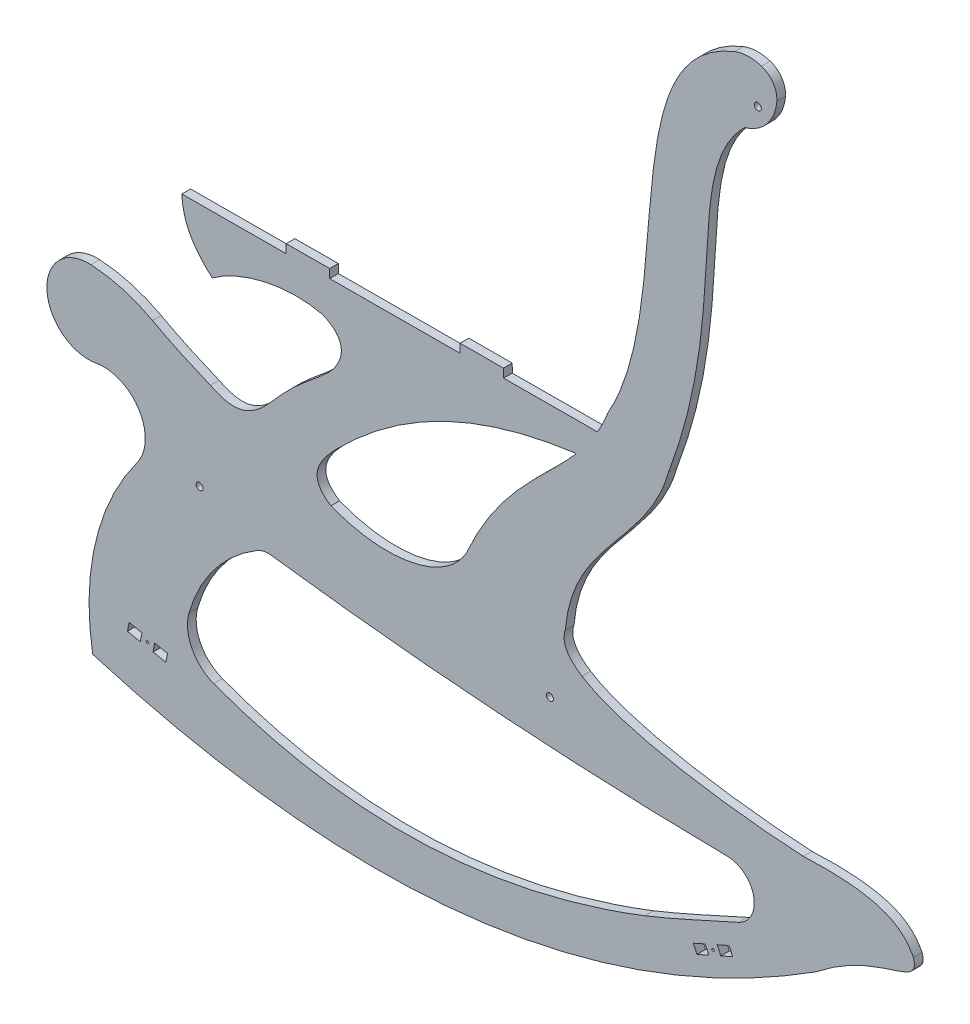
from build123d import *

# Parameters (mm, degrees)
EXTRUDE_3344_DEPTH     = 10
EXTRUDE_7001_DEPTH     = 10
CUT_EXTRUDE_7885_REACH = 1081.252
SKETCH6_R              = 1.5
SKETCH10_R             = 4
CUT_EXTRUDE2_DEPTH     = 10


with BuildPart() as part:
    # Sketch 366 → Extrude 3344 (new body)
    with BuildSketch(Plane.XY):
        with BuildLine():
            Line((398.785011417, -200.651493516), (-79.294784876, -202.700029576))
            add(Edge.make_bspline(
                [(-79.294784876, -202.700029576), (-78.517207033, -227.700030074), (-66.77413567, -249.709423293), (-44.177194857, -268.758733778)],
                knots=[0.130434783, 0.130434783, 0.130434783, 0.130434783, 0.173913043, 0.173913043, 0.173913043, 0.173913043], degree=3))
            add(Edge.make_bspline(
                [(-44.177194857, -268.758733778), (-12.705791537, -245.829015584), (38.959692419, -231.734357298), (82.666649693, -241.803965427)],
                knots=[0.173913043, 0.173913043, 0.173913043, 0.173913043, 0.217391304, 0.217391304, 0.217391304, 0.217391304], degree=3))
            add(Edge.make_bspline(
                [(82.666649693, -241.803965427), (105.678664452, -251.652519997), (111.246401119, -268.691898993), (94.211511027, -290.72343747)],
                knots=[0.217391304, 0.217391304, 0.217391304, 0.217391304, 0.260869565, 0.260869565, 0.260869565, 0.260869565], degree=3))
            add(Edge.make_bspline(
                [(94.211511027, -290.72343747), (87.158146802, -299.84568745), (74.983143168, -308.421687748), (61.059861243, -320.502125148)],
                knots=[0.260869565, 0.260869565, 0.260869565, 0.260869565, 0.304347826, 0.304347826, 0.304347826, 0.304347826], degree=3))
            add(Edge.make_bspline(
                [(61.059861243, -320.502125148), (47.380576162, -331.841195194), (34.883169502, -345.267804883), (22.870464668, -359.106695422)],
                knots=[0.304347826, 0.304347826, 0.304347826, 0.304347826, 0.347826087, 0.347826087, 0.347826087, 0.347826087], degree=3))
            add(Edge.make_bspline(
                [(22.870464668, -359.106695422), (-5.584395486, -391.889656597), (-25.592236503, -386.636342684), (-46.417157713, -376.787588607)],
                knots=[0.347826087, 0.347826087, 0.347826087, 0.347826087, 0.391304348, 0.391304348, 0.391304348, 0.391304348], degree=3))
            add(Edge.make_bspline(
                [(-46.417157713, -376.787588607), (-71.990241561, -366.221906762), (-92.784039707, -356.68149048), (-112.974728727, -345.609360564)],
                knots=[0.391304348, 0.391304348, 0.391304348, 0.391304348, 0.434782609, 0.434782609, 0.434782609, 0.434782609], degree=3))
            ThreePointArc((-112.974728727, -345.609360564), (-147.291018167, -331.50605668), (-183.878601839, -325.353039337))
            ThreePointArc((-183.878601839, -325.353039337), (-234.41691777, -376.347060605), (-177.788935429, -420.480757462))
            ThreePointArc((-177.788935429, -420.480757462), (-128.557787466, -442.172804122), (-130.703269603, -495.928247794))
            ThreePointArc((-130.703269603, -495.928247794), (-178.505297895, -598.929354982), (-181.694355183, -712.437468808))
            add(Edge.make_bspline(
                [(-181.694355183, -712.437468808), (138.462224148, -807.731703363), (410.691079854, -765.39904884), (650.190442214, -612.598169561)],
                knots=[0.652173913, 0.652173913, 0.652173913, 0.652173913, 0.695652174, 0.695652174, 0.695652174, 0.695652174], degree=3))
            add(Edge.make_bspline(
                [(650.190442214, -612.598169561), (721.726306985, -555.13661338), (771.374178439, -572.802842814), (761.971022851, -542.438303349)],
                knots=[0.695652174, 0.695652174, 0.695652174, 0.695652174, 0.739130435, 0.739130435, 0.739130435, 0.739130435], degree=3))
            add(Edge.make_bspline(
                [(761.971022851, -542.438303349), (749.988144288, -518.251093648), (723.103402832, -500.836242812), (635.239899657, -505.006434182)],
                knots=[0.739130435, 0.739130435, 0.739130435, 0.739130435, 0.782608696, 0.782608696, 0.782608696, 0.782608696], degree=3))
            add(Edge.make_bspline(
                [(635.239899657, -505.006434182), (572.991975282, -501.932832065), (433.550272387, -486.778792548), (380.910397107, -452.903731023)],
                knots=[0.782608696, 0.782608696, 0.782608696, 0.782608696, 0.826086957, 0.826086957, 0.826086957, 0.826086957], degree=3))
            add(Edge.make_bspline(
                [(380.910397107, -452.903731023), (364.765905966, -442.514313456), (356.786231562, -430.363849161), (361.702578451, -416.260911342)],
                knots=[0.826086957, 0.826086957, 0.826086957, 0.826086957, 0.869565217, 0.869565217, 0.869565217, 0.869565217], degree=3))
            add(Edge.make_bspline(
                [(361.702578451, -416.260911342), (369.757666434, -319.561849491), (455.747401527, -287.137003064), (480.242749516, -200.302456329)],
                knots=[0.869565217, 0.869565217, 0.869565217, 0.869565217, 0.913043478, 0.913043478, 0.913043478, 0.913043478], degree=3))
            add(Edge.make_bspline(
                [(480.242749516, -200.302456329), (553.544349425, -5.601453319), (495.010045056, 115.276837959), (568.085803242, 187.174308847)],
                knots=[0.913043478, 0.913043478, 0.913043478, 0.913043478, 0.956521739, 0.956521739, 0.956521739, 0.956521739], degree=3))
            ThreePointArc((568.085803242, 187.174308847), (593.606841589, 203.592061702), (604.925253944, 231.748047725))
            ThreePointArc((604.925253944, 231.748047725), (600.64196866, 247.878688747), (587.30163028, 257.907621119))
            ThreePointArc((587.30163028, 257.907621119), (571.737485415, 260.097118561), (556.344046154, 256.922448156))
            add(Edge.make_bspline(
                [(556.344046154, 256.922448156), (413.493143177, 200.699964154), (492.80385804, -30.446360595), (410.726691822, -175.599321984)],
                knots=[0.000400641, 0.000400641, 0.000400641, 0.000400641, 0.043478261, 0.043478261, 0.043478261, 0.043478261], degree=3))
            add(Edge.make_bspline(
                [(410.726691822, -175.599321984), (407.231033021, -184.649150987), (403.219250068, -192.928185379), (398.785011417, -200.651493516)],
                knots=[0.043478261, 0.043478261, 0.043478261, 0.043478261, 0.086956522, 0.086956522, 0.086956522, 0.086956522], degree=3))
        make_face()
        with BuildLine():
            ThreePointArc((560.346734066, -608.221488629), (578.34219742, -573.494082411), (548.198906447, -548.569968521))
            ThreePointArc((548.198906447, -548.569968521), (285.319700334, -537.637629059), (23.550736383, -511.142298049))
            ThreePointArc((23.550736383, -511.142298049), (15.100477301, -511.443853236), (7.211162456, -514.486307076))
            ThreePointArc((7.211162456, -514.486307076), (-41.568101768, -557.565567627), (-70.986403303, -615.615570579))
            ThreePointArc((-70.986403303, -615.615570579), (-67.830334276, -649.354197638), (-42.606278131, -671.981674723))
            add(Edge.make_bspline(
                [(452.957398359, -655.370237863), (274.711219353, -724.494962923), (109.739326577, -728.980973594), (-42.606278131, -671.981674723)],
                knots=[0.555555556, 0.555555556, 0.555555556, 0.555555556, 0.666666667, 0.666666667, 0.666666667, 0.666666667], degree=3))
            add(Edge.make_bspline(
                [(560.346734066, -608.221488629), (524.550322081, -623.937738374), (490.70019891, -640.488126146), (452.957398359, -655.370237863)],
                knots=[0.444444444, 0.444444444, 0.444444444, 0.444444444, 0.555555556, 0.555555556, 0.555555556, 0.555555556], degree=3))
        make_face(mode=Mode.SUBTRACT)
        with BuildLine():
            add(Edge.make_bspline(
                [(97.461776435, -368.948566513), (168.620673064, -296.351125936), (255.441952596, -250.089184531), (374.508522413, -234.330838847)],
                knots=[0.75, 0.75, 0.75, 0.75, 1, 1, 1, 1], degree=3))
            add(Edge.make_bspline(
                [(374.508522413, -234.330838847), (336.704373514, -278.003480948), (285.636212987, -310.964302456), (247.882738821, -396.645799506)],
                knots=[0, 0, 0, 0, 0.25, 0.25, 0.25, 0.25], degree=3))
            add(Edge.make_bspline(
                [(247.882738821, -396.645799506), (222.475445143, -441.097914765), (152.691350033, -451.719558275), (92.090753497, -427.546413805)],
                knots=[0.25, 0.25, 0.25, 0.25, 0.5, 0.5, 0.5, 0.5], degree=3))
            add(Edge.make_bspline(
                [(92.090753497, -427.546413805), (69.794668972, -412.531131284), (70.490548771, -396.456667038), (97.461776435, -368.948566513)],
                knots=[0.5, 0.5, 0.5, 0.5, 0.75, 0.75, 0.75, 0.75], degree=3))
        make_face(mode=Mode.SUBTRACT)
    extrude(amount=EXTRUDE_3344_DEPTH)

    # Sketch5 → Extrude 7001 (add)
    with BuildSketch(Plane.XY.offset(10)):
        Polygon((40.661264648, -192.185935101), (90.66080564, -191.971690819), (90.703654496, -201.971599017), (40.704113505, -202.185843299), align=None)
        Polygon((240.659428615, -191.328957973), (290.658969607, -191.114713691), (290.701818463, -201.114621889), (240.702277472, -201.328866171), align=None)
    extrude(amount=-EXTRUDE_7001_DEPTH)

    # Sketch6 → Cut-Extrude 7885 (cut, up to next)
    with BuildSketch(Plane.XY.offset(10), mode=Mode.PRIVATE) as cut_extrude_7885_sk1:
        with Locations((531.551481114, -650.112952006)):
            Circle(SKETCH6_R)
    cut_extrude_7885_tool1 = extrude(cut_extrude_7885_sk1.sketch, amount=-CUT_EXTRUDE_7885_REACH, mode=Mode.PRIVATE) & part.part
    # Sketch6 → Cut-Extrude 7885 (cut, up to next)
    with BuildSketch(Plane.XY.offset(10), mode=Mode.PRIVATE) as cut_extrude_7885_sk2:
        with Locations((-118.7617531, -668.979567573)):
            Circle(SKETCH6_R)
    cut_extrude_7885_tool2 = extrude(cut_extrude_7885_sk2.sketch, amount=-CUT_EXTRUDE_7885_REACH, mode=Mode.PRIVATE) & part.part
    # Sketch6 → Cut-Extrude 7885 (cut, up to next)
    with BuildSketch(Plane.XY.offset(10), mode=Mode.PRIVATE) as cut_extrude_7885_sk3:
        Polygon((-139.846242547, -659.668589925), (-141.805292897, -669.474818645), (-127.095949816, -672.413394171), (-125.136899465, -662.60716545), align=None)
    cut_extrude_7885_tool3 = extrude(cut_extrude_7885_sk3.sketch, amount=-CUT_EXTRUDE_7885_REACH, mode=Mode.PRIVATE) & part.part
    # Sketch6 → Cut-Extrude 7885 (cut, up to next)
    with BuildSketch(Plane.XY.offset(10), mode=Mode.PRIVATE) as cut_extrude_7885_sk4:
        Polygon((-112.386606734, -675.351969696), (-110.427556384, -665.545740975), (-95.718213303, -668.4843165), (-97.677263653, -678.290545221), align=None)
    cut_extrude_7885_tool4 = extrude(cut_extrude_7885_sk4.sketch, amount=-CUT_EXTRUDE_7885_REACH, mode=Mode.PRIVATE) & part.part
    # Sketch6 → Cut-Extrude 7885 (cut, up to next)
    with BuildSketch(Plane.XY.offset(10), mode=Mode.PRIVATE) as cut_extrude_7885_sk5:
        Polygon((554.142933289, -645.543894263), (540.435760059, -651.635971254), (536.374375399, -642.497855768), (550.081548628, -636.405778777), align=None)
    cut_extrude_7885_tool5 = extrude(cut_extrude_7885_sk5.sketch, amount=-CUT_EXTRUDE_7885_REACH, mode=Mode.PRIVATE) & part.part
    # Sketch6 → Cut-Extrude 7885 (cut, up to next)
    with BuildSketch(Plane.XY.offset(10), mode=Mode.PRIVATE) as cut_extrude_7885_sk6:
        Polygon((522.667202169, -648.589932758), (508.96002894, -654.682009749), (513.021413601, -663.820125235), (526.72858683, -657.728048245), align=None)
    cut_extrude_7885_tool6 = extrude(cut_extrude_7885_sk6.sketch, amount=-CUT_EXTRUDE_7885_REACH, mode=Mode.PRIVATE) & part.part
    add(cut_extrude_7885_tool1.solids().sort_by_distance((531.551481, -650.112952, 10))[0], mode=Mode.SUBTRACT)
    add(cut_extrude_7885_tool2.solids().sort_by_distance((-118.761753, -668.979568, 10))[0], mode=Mode.SUBTRACT)
    add(cut_extrude_7885_tool3.solids().sort_by_distance((-133.471096, -666.040992, 10))[0], mode=Mode.SUBTRACT)
    add(cut_extrude_7885_tool4.solids().sort_by_distance((-104.05241, -671.918143, 10))[0], mode=Mode.SUBTRACT)
    add(cut_extrude_7885_tool5.solids().sort_by_distance((545.258654, -644.020875, 10))[0], mode=Mode.SUBTRACT)
    add(cut_extrude_7885_tool6.solids().sort_by_distance((517.844308, -656.205029, 10))[0], mode=Mode.SUBTRACT)

    # Sketch10 → Cut-Extrude2 (cut)
    with BuildSketch(Plane.XY.offset(10)):
        with Locations((-58.805785282, -483.725185308)):
            Circle(SKETCH10_R)
        with Locations((343.930985097, -492.062373655)):
            Circle(SKETCH10_R)
        with Locations((583.096913772, 215.46802458)):
            Circle(SKETCH10_R)
    extrude(amount=-CUT_EXTRUDE2_DEPTH, mode=Mode.SUBTRACT)


solid = part.part
